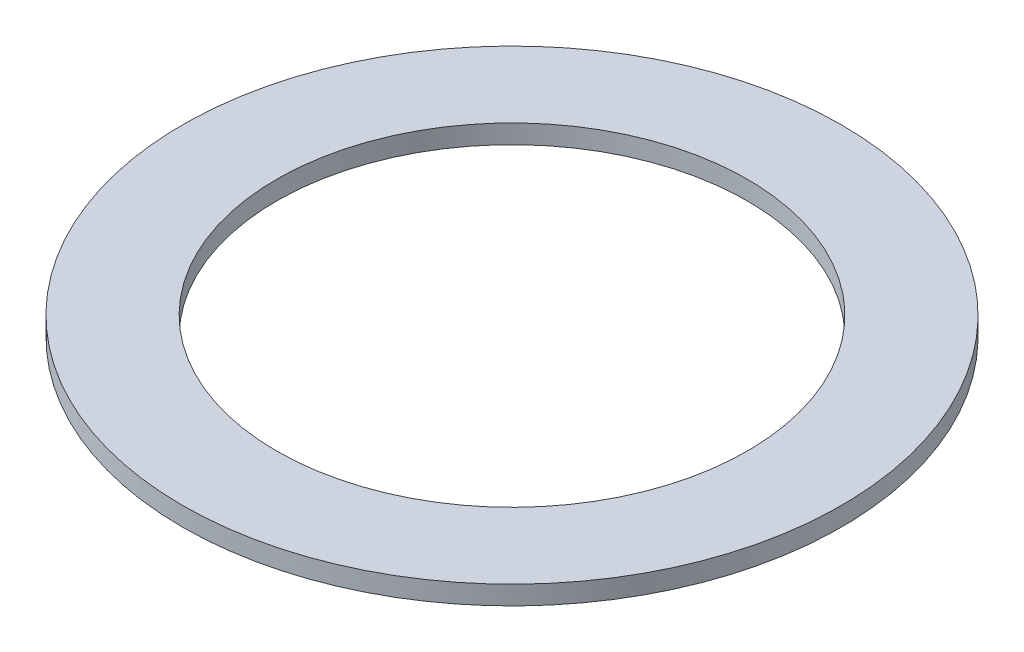
from build123d import *

# Parameters (mm, degrees)
SKETCH1_W = 1
SKETCH1_H = 0.2


with BuildPart() as part:
    # Sketch1 → Revolve1 (revolve)
    with BuildSketch(Plane(origin=(0, 0, 0), x_dir=(0, 0, -1), z_dir=(1, 0, 0)), mode=Mode.PRIVATE) as revolve1_sk:
        with Locations((3, 0)):
            Rectangle(SKETCH1_W, SKETCH1_H)
    revolve(revolve1_sk.sketch.rotate(Axis((0, 12.343867532, 0), (0, -1, 0)), 180), axis=Axis((0, 12.343867532, 0), (0, -1, 0)))


solid = part.part
